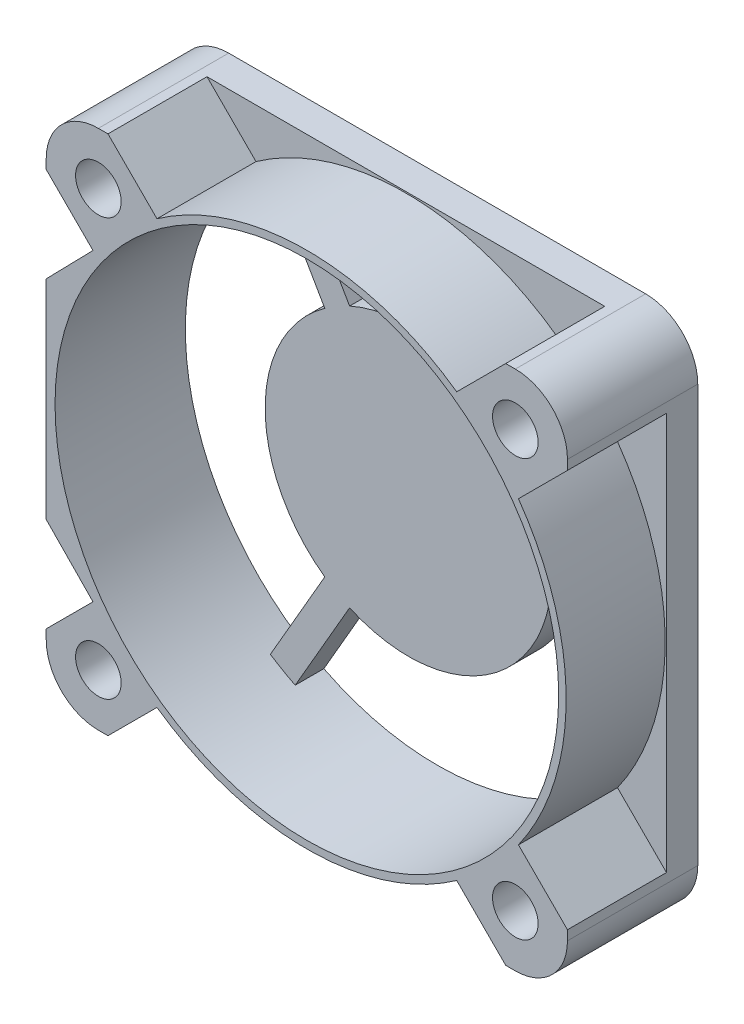
from build123d import *

# Parameters (mm, degrees)
SKETCH21_W          = 40
SKETCH21_H          = 40
BOSS_EXTRUDE4_DEPTH = 5
FILLET3_R           = 4
SKETCH22_R          = 19.325
CUT_EXTRUDE11_DEPTH = 31
CUT_EXTRUDE12_DEPTH = 7.6
CUT_EXTRUDE13_REACH = 32
SKETCH30_R          = 1.75
CIRPATTERN2_COUNT   = 4
BOSS_EXTRUDE3_START = -2.2
BOSS_EXTRUDE3_DEPTH = 2.2
BOSS_EXTRUDE5_REACH = 32


with BuildPart() as part:
    # Sketch21 → Boss-Extrude4 (new, symmetric)
    with BuildSketch(Plane.XY):
        Rectangle(SKETCH21_W, SKETCH21_H)
    extrude(amount=BOSS_EXTRUDE4_DEPTH, both=True)

    # Fillet3
    fillet3_edges = [part.edges().sort_by_distance(p)[0] for p in [
        (20, -20, 0),
        (-20, -20, 0),
        (-20, 20, 0),
        (20, 20, 0),
    ]]
    fillet(fillet3_edges, radius=FILLET3_R)

    # Sketch22 → Cut-Extrude11 (cut, through all)
    with BuildSketch(Plane.XY.offset(5)):
        Circle(SKETCH22_R)
    extrude(amount=-CUT_EXTRUDE11_DEPTH, mode=Mode.SUBTRACT)

    # Sketch23 → Cut-Extrude12 (cut)
    with BuildSketch(Plane.XY.offset(5)):
        with BuildLine():
            Line((15.262384566, 20), (11.501799696, 16.23941513))
            ThreePointArc((11.501799696, 16.23941513), (0, 19.9), (-11.501799696, 16.23941513))
            Line((-11.501799696, 16.23941513), (-15.262384566, 20))
            Line((-15.262384566, 20), (15.262384566, 20))
        make_face()
    cut_extrude12 = extrude(amount=-CUT_EXTRUDE12_DEPTH, mode=Mode.SUBTRACT)

    # Sketch30 → Cut-Extrude13 (cut, up to next)
    with BuildSketch(Plane.XY.offset(5), mode=Mode.PRIVATE) as cut_extrude13_sk1:
        with Locations((-16, 16)):
            Circle(SKETCH30_R)
    cut_extrude13_tool1 = extrude(cut_extrude13_sk1.sketch, amount=-CUT_EXTRUDE13_REACH, mode=Mode.PRIVATE) & part.part
    cut_extrude13 = cut_extrude13_tool1.solids().sort_by_distance((-16, 16, 5))[0]
    add(cut_extrude13, mode=Mode.SUBTRACT)

    # CirPattern2: Cut-Extrude12, Cut-Extrude13 ×4 about axis
    cirpattern2_axis = Axis((0, 0, 0), (0, 0, 1))
    add([cut_extrude12.rotate(cirpattern2_axis, i * 360 / CIRPATTERN2_COUNT) for i in range(1, CIRPATTERN2_COUNT)], mode=Mode.SUBTRACT)
    add([cut_extrude13.rotate(cirpattern2_axis, i * 360 / CIRPATTERN2_COUNT) for i in range(1, CIRPATTERN2_COUNT)], mode=Mode.SUBTRACT)

    # Sketch20 → Boss-Extrude3 (add)
    with BuildSketch(Plane(origin=(0, 0, -5), x_dir=(-1, 0, 0), z_dir=(0, 0, -1)).offset(BOSS_EXTRUDE3_START)):
        with BuildLine():
            Line((6.425058848, 8.928528367), (10.599461946, 16.158806623))
            ThreePointArc((10.599461946, 16.158806623), (9.6625, 16.735940928), (8.694206057, 17.258806623))
            Line((8.694206057, 17.258806623), (4.51980296, 10.028528367))
            ThreePointArc((4.51980296, 10.028528367), (-5.5, 9.526279442), (-10.944861808, 1.1))
            Line((-10.944861808, 1.1), (-19.293668003, 1.1))
            ThreePointArc((-19.293668003, 1.1), (-19.325, 0), (-19.293668003, -1.1))
            Line((-19.293668003, -1.1), (-10.944861808, -1.1))
            ThreePointArc((-10.944861808, -1.1), (-5.5, -9.526279442), (4.51980296, -10.028528367))
            Line((4.51980296, -10.028528367), (8.694206057, -17.258806623))
            ThreePointArc((8.694206057, -17.258806623), (9.6625, -16.735940928), (10.599461946, -16.158806623))
            Line((10.599461946, -16.158806623), (6.425058848, -8.928528367))
            ThreePointArc((6.425058848, -8.928528367), (11, 0), (6.425058848, 8.928528367))
        make_face()
    extrude(amount=BOSS_EXTRUDE3_DEPTH)

    # Sketch31 → Boss-Extrude5 (add, up to next)
    with BuildSketch(Plane.XY.offset(5), mode=Mode.PRIVATE) as boss_extrude5_sk1:
        with BuildLine():
            Line((-14.240301081, 13.900497298), (-20, 8))
            Line((-20, 8), (-20, -8))
            Line((-20, -8), (-14.240301081, -13.900497298))
            ThreePointArc((-14.240301081, -13.900497298), (-19.9, 0), (-14.240301081, 13.900497298))
        make_face()
    boss_extrude5_tool1 = extrude(boss_extrude5_sk1.sketch, amount=-BOSS_EXTRUDE5_REACH, mode=Mode.PRIVATE) - part.part
    add(boss_extrude5_tool1.solids().sort_by_distance((-19.928391, 0, 5))[0])


solid = part.part
